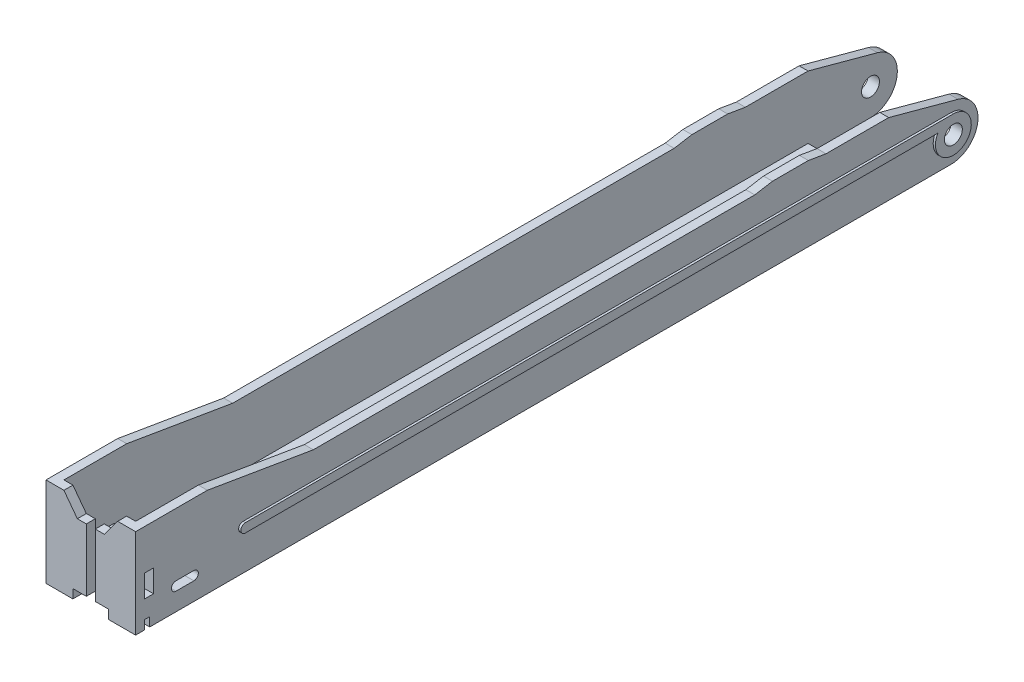
from build123d import *

# Parameters (mm, degrees)
SKETCH1_W               = 15.875
SKETCH1_H               = 15.875
BOSS_EXTRUDE1_DEPTH     = 149.225
CUT_EXTRUDE1_DEPTH      = 151.276811772
CUT_EXTRUDE1_DEPTH_BACK = 151.276811772
CUT_EXTRUDE2_START      = -1.5875
SKETCH4_W               = 12.7
SKETCH4_H               = 14.2875
CUT_EXTRUDE2_DEPTH      = 149.225
CUT_EXTRUDE4_DEPTH      = 151.276811772
SKETCH6_W               = 6.35
SKETCH6_H               = 1.5875
CUT_EXTRUDE5_DEPTH      = 1.5875
SKETCH7_W               = 1.5875
SKETCH7_H               = 0.910155424
CUT_EXTRUDE6_DEPTH      = 1.5875
SKETCH8_R               = 1.5875
SKETCH8_W               = 1.5875
SKETCH8_H               = 3.96875
CUT_EXTRUDE7_DEPTH      = 151.276811772
SKETCH9_R               = 3.175
CUT_EXTRUDE8_DEPTH      = 151.276811772
BOSS_EXTRUDE2_START     = 0.396875
SKETCH10_R              = 1.5875
BOSS_EXTRUDE2_DEPTH     = 0.396875
SKETCH11_W              = 12.7
SKETCH11_H              = 14.601302857
CUT_EXTRUDE9_DEPTH      = 2.54


with BuildPart() as part:
    # Sketch1 → Boss-Extrude1 (new body)
    with BuildSketch(Plane.XY):
        Rectangle(SKETCH1_W, SKETCH1_H)
    extrude(amount=-BOSS_EXTRUDE1_DEPTH)

    # Sketch2 → Cut-Extrude1 (cut, two sides: drawn at the far end of the back side and taken through both)
    with BuildSketch(Plane(origin=(7.9375, 0, 0), x_dir=(0, 0, -1), z_dir=(1, 0, 0)).offset(-CUT_EXTRUDE1_DEPTH_BACK)):
        with BuildLine():
            Line((149.225, 7.9375), (12.7, 7.9375))
            Line((12.7, 7.9375), (31.483553311, 4.7625))
            Line((31.483553311, 4.7625), (109.68727062, 4.7625))
            Line((109.68727062, 4.7625), (112.817862839, 5.291666667))
            Line((112.817862839, 5.291666667), (119.167862839, 5.291666667))
            Line((119.167862839, 5.291666667), (122.298455057, 4.7625))
            Line((122.298455057, 4.7625), (133.410955057, 4.7625))
            Line((133.410955057, 4.7625), (145.71107606, 1.420918197))
            ThreePointArc((145.71107606, 1.420918197), (148.245868191, -0.282331443), (149.225, -3.175))
            Line((149.225, -3.175), (149.225, 7.9375))
        make_face()
        with BuildLine():
            Line((149.225, -7.9375), (149.225, -3.175))
            ThreePointArc((149.225, -3.175), (147.830096045, -6.542596045), (144.4625, -7.9375))
            Line((144.4625, -7.9375), (149.225, -7.9375))
        make_face()
    extrude(amount=CUT_EXTRUDE1_DEPTH + CUT_EXTRUDE1_DEPTH_BACK, mode=Mode.SUBTRACT)

    # Sketch4 → Cut-Extrude2 (cut)
    with BuildSketch(Plane.XY.offset(CUT_EXTRUDE2_START)):
        with Locations((0, 0.79375)):
            Rectangle(SKETCH4_W, SKETCH4_H)
    extrude(amount=-CUT_EXTRUDE2_DEPTH, mode=Mode.SUBTRACT)

    # Sketch5 → Cut-Extrude4 (cut, through all)
    with BuildSketch(Plane.XZ.offset(7.9375)):
        Polygon((2.38125, -6.35), (-2.38125, -6.35), (-4.283584011, -2.497655424), (-6.35, -2.497655424), (-6.35, -1.5875), (-0.79375, -1.5875), (-0.79375, 0), (0.79375, 0), (0.79375, -1.5875), (6.35, -1.5875), (6.35, -2.497655424), (4.283584011, -2.497655424), align=None)
    extrude(amount=-CUT_EXTRUDE4_DEPTH, mode=Mode.SUBTRACT)

    # Sketch6 → Cut-Extrude5 (cut)
    with BuildSketch(Plane.XY):
        Polygon((0.79375, 4.7625), (2.38125, 4.7625), (4.7625, 7.9375), (0.79375, 7.9375), align=None)
        Polygon((-0.79375, 4.7625), (-2.38125, 4.7625), (-4.7625, 7.9375), (-0.79375, 7.9375), align=None)
        with Locations((0, -7.14375)):
            Rectangle(SKETCH6_W, SKETCH6_H)
    extrude(amount=-CUT_EXTRUDE5_DEPTH, mode=Mode.SUBTRACT)

    # Sketch7 → Cut-Extrude6 (cut)
    with BuildSketch(Plane.XZ.offset(7.9375)):
        with Locations((7.14375, -2.042577712)):
            Rectangle(SKETCH7_W, SKETCH7_H)
        with Locations((-7.14375, -2.042577712)):
            Rectangle(SKETCH7_W, SKETCH7_H)
    extrude(amount=-CUT_EXTRUDE6_DEPTH, mode=Mode.SUBTRACT)

    # Sketch8 → Cut-Extrude7 (cut, through all)
    with BuildSketch(Plane(origin=(7.9375, 0, 0), x_dir=(0, 0, -1), z_dir=(1, 0, 0))):
        with Locations((144.4625, -3.175)):
            Circle(SKETCH8_R)
        with Locations((2.38125, -1.190625)):
            Rectangle(SKETCH8_W, SKETCH8_H)
        with BuildLine():
            Line((7.14375, -3.175), (10.31875, -3.175))
            ThreePointArc((10.31875, -3.175), (11.1125, -3.96875), (10.31875, -4.7625))
            Line((10.31875, -4.7625), (7.14375, -4.7625))
            ThreePointArc((7.14375, -4.7625), (6.35, -3.96875), (7.14375, -3.175))
        make_face()
    extrude(amount=-CUT_EXTRUDE7_DEPTH, mode=Mode.SUBTRACT)

    # Sketch9 → Cut-Extrude8 (cut, through all)
    with BuildSketch(Plane.XZ.offset(7.9375)):
        with Locations(Location((0, -22.225, 0), (0, 0, 270))):
            Circle(SKETCH9_R)
        with Locations(Location((0, -122.2375, 0), (0, 0, 270))):
            Circle(SKETCH9_R)
    extrude(amount=-CUT_EXTRUDE8_DEPTH, mode=Mode.SUBTRACT)

    # Sketch10 → Boss-Extrude2 (add)
    with BuildSketch(Plane(origin=(7.9375, 0, 0), x_dir=(0, 0, -1), z_dir=(1, 0, 0)).offset(BOSS_EXTRUDE2_START)):
        with BuildLine():
            Line((144.4625, 0), (19.05, 0))
            ThreePointArc((19.05, 0), (18.25625, -0.79375), (19.05, -1.5875))
            Line((19.05, -1.5875), (141.712869343, -1.5875))
            ThreePointArc((141.712869343, -1.5875), (146.05, -5.924630657), (144.4625, 0))
        make_face()
        with Locations((144.4625, -3.175)):
            Circle(SKETCH10_R, mode=Mode.SUBTRACT)
    boss_extrude2 = extrude(amount=-BOSS_EXTRUDE2_DEPTH)

    # Mirror1: Boss-Extrude2 across plane
    add(boss_extrude2.mirror(Plane(origin=(0, 0, 0), x_dir=(0, 0, 1), z_dir=(1, 0, 0))))

    # Sketch11 → Cut-Extrude9 (cut)
    with BuildSketch(Plane(origin=(0, -6.35, 0), x_dir=(1, 0, 0), z_dir=(0, 1, 0))):
        with Locations((0, 140.711606485)):
            Rectangle(SKETCH11_W, SKETCH11_H)
    extrude(amount=-CUT_EXTRUDE9_DEPTH, mode=Mode.SUBTRACT)


solid = part.part
